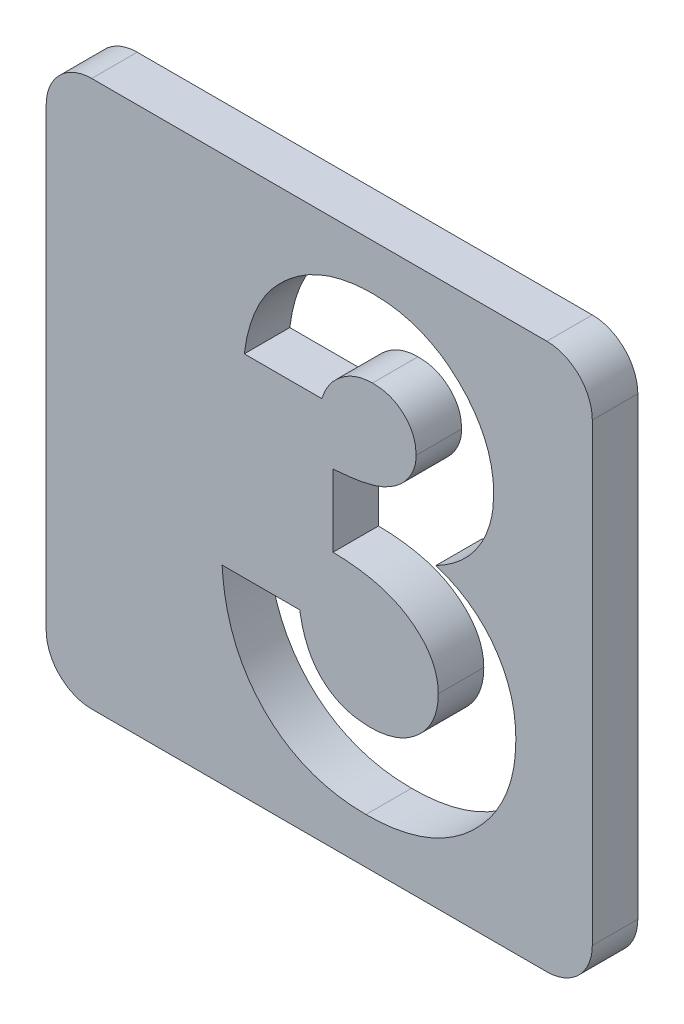
from build123d import *

# Parameters (mm, degrees)
BOSS_EXTRUDE1_DEPTH = 10
CUT_EXTRUDE1_DEPTH  = 10


with BuildPart() as part:
    # Sketch1 → Boss-Extrude1 (new body)
    with BuildSketch(Plane.XY):
        with BuildLine():
            Line((-50, 60), (50, 60))
            ThreePointArc((50, 60), (57.071067812, 57.071067812), (60, 50))
            Line((60, 50), (60, -50))
            ThreePointArc((60, -50), (57.071067812, -57.071067812), (50, -60))
            Line((50, -60), (-50, -60))
            ThreePointArc((-50, -60), (-57.071067812, -57.071067812), (-60, -50))
            Line((-60, -50), (-60, 50))
            ThreePointArc((-60, 50), (-57.071067812, 57.071067812), (-50, 60))
        make_face()
    extrude(amount=BOSS_EXTRUDE1_DEPTH)

    # Sketch2 → Cut-Extrude1 (cut)
    with BuildSketch(Plane.XY.offset(10)):
        with BuildLine():
            Line((0.576923077, 24.358974359), (-16.474358974, 24.358974359))
            add(Edge.make_bspline(
                [(-16.474358974, 24.358974359), (-16.353970438, 25.211307119), (-16.117956688, 26.882249036), (-15.553207348, 29.301356677), (-14.877706194, 31.596045832), (-14.034377515, 33.75904969), (-13.045290174, 35.794221276), (-11.920502083, 37.708544306), (-10.647853859, 39.493802146), (-9.672355516, 40.569248555), (-9.185697115, 41.105769231)],
                knots=[0, 0, 0, 0, 1.111473889, 2.178970933, 3.205615836, 4.199322666, 5.174200091, 6.12565194, 7.064921805, 8, 8, 8, 8], degree=3))
            add(Edge.make_bspline(
                [(-9.185697115, 41.105769231), (-8.483756858, 41.813669386), (-7.10030638, 43.208866194), (-4.788398372, 44.995959193), (-2.365091827, 46.542566651), (0.218213736, 47.768728226), (2.92132013, 48.761163974), (5.765723399, 49.427785309), (8.739800279, 49.87009445), (10.769233604, 49.913663441), (11.804887821, 49.935897436)],
                knots=[0, 0, 0, 0, 1.01925491, 2.00884431, 2.983262333, 3.955970413, 4.92937149, 5.924503185, 6.940838805, 8, 8, 8, 8], degree=3))
            add(Edge.make_bspline(
                [(11.804887821, 49.935897436), (12.725637707, 49.914160335), (14.535646445, 49.871429576), (17.19590386, 49.528410226), (19.732236676, 48.926792485), (22.171454673, 48.140190789), (24.477684901, 47.069887718), (26.701828098, 45.82749366), (28.781741625, 44.303645718), (30.722292085, 42.581850898), (32.505057791, 40.719561249), (34.048940704, 38.728926766), (35.376244548, 36.663121884), (36.469767354, 34.504983674), (37.31053779, 32.250860305), (37.894057408, 29.913773543), (38.275985165, 27.498880346), (38.31403515, 25.857509967), (38.333333333, 25.025040064)],
                knots=[0, 0, 0, 0, 1.091422571, 2.145516843, 3.172569842, 4.178562979, 5.178154469, 6.181868002, 7.194278174, 8.227918432, 9.254613415, 10.245994977, 11.209837596, 12.161663635, 13.10878368, 14.055455738, 15.013766427, 16, 16, 16, 16], degree=3))
            add(Edge.make_bspline(
                [(38.333333333, 25.025040064), (38.293732308, 23.994095409), (38.215770063, 21.964482346), (37.576033403, 18.993992832), (36.574671568, 16.153674752), (35.128107, 13.483268429), (33.319532856, 10.990041205), (31.100472953, 8.757349154), (28.534131878, 6.750186691), (26.607545449, 5.671537337), (25.62099359, 5.119190705)],
                knots=[0, 0, 0, 0, 0.992805628, 1.954529043, 2.915727527, 3.886831945, 4.871318353, 5.87440735, 6.911542536, 8, 8, 8, 8], degree=3))
            add(Edge.make_bspline(
                [(25.62099359, 5.119190705), (26.298147652, 4.896866769), (27.628725011, 4.460010206), (29.51998074, 3.599626149), (31.31834883, 2.659368988), (32.99286203, 1.567038026), (34.560175394, 0.366802286), (36.010734394, -0.951598279), (37.353205786, -2.385288944), (38.565674269, -3.942154462), (39.641787421, -5.5972958), (40.607326451, -7.312480175), (41.402018895, -9.113718663), (42.07522233, -10.980439908), (42.587761098, -12.929421022), (42.94863419, -14.953109858), (43.157227694, -17.046890251), (43.189041761, -18.465425199), (43.205128205, -19.182692308)],
                knots=[0, 0, 0, 0, 1.059543567, 2.081955587, 3.086750234, 4.076226789, 5.052108497, 6.020845489, 6.989030705, 7.970690546, 8.952259656, 9.923888338, 10.895517021, 11.877585046, 12.873342345, 13.889638361, 14.932918083, 16, 16, 16, 16], degree=3))
            add(Edge.make_bspline(
                [(43.205128205, -19.182692308), (43.17251882, -20.236783738), (43.108219755, -22.315237362), (42.699436391, -25.376586846), (41.938355422, -28.295311592), (40.937111249, -31.104995931), (39.601560188, -33.769367864), (38.029841121, -36.34957109), (36.097882591, -38.756124872), (33.950842418, -41.052652256), (31.566429135, -43.140552122), (28.981337229, -44.950667352), (26.252410658, -46.504068279), (23.362384275, -47.765163409), (20.312262141, -48.736350893), (17.108842711, -49.438369972), (13.738666093, -49.86787686), (11.438256871, -49.912902514), (10.263421474, -49.935897436)],
                knots=[0, 0, 0, 0, 1.005138573, 1.981928558, 2.936866704, 3.876260664, 4.820238198, 5.773547, 6.751179199, 7.756627054, 8.768222608, 9.766606018, 10.760583154, 11.757261445, 12.767156078, 13.807575856, 14.880313354, 16, 16, 16, 16], degree=3))
            add(Edge.make_bspline(
                [(10.263421474, -49.935897436), (9.152046138, -49.911653178), (6.978898733, -49.86424674), (3.800215835, -49.453919993), (0.779178625, -48.792029652), (-2.09192263, -47.859040331), (-4.801979884, -46.649112625), (-7.375568975, -45.208360206), (-9.761334505, -43.453683826), (-11.985858603, -41.464292892), (-13.999794607, -39.232309222), (-15.799779124, -36.809435607), (-17.34612218, -34.186458852), (-18.645165347, -31.374585409), (-19.686753045, -28.368882405), (-20.508354364, -25.175462089), (-21.082256332, -21.788085508), (-21.25703938, -19.457498358), (-21.346153846, -18.269230769)],
                knots=[0, 0, 0, 0, 1.066544725, 2.085487077, 3.070979577, 4.031932826, 4.977951092, 5.916076795, 6.857635327, 7.814973522, 8.776389752, 9.738577119, 10.707772778, 11.69409279, 12.707140348, 13.757286496, 14.856535458, 16, 16, 16, 16], degree=3))
            Line((-21.346153846, -18.269230769), (-4.294871795, -18.269230769))
            add(Edge.make_bspline(
                [(-4.294871795, -18.269230769), (-4.186819599, -18.866707312), (-3.97635961, -20.030449564), (-3.56587031, -21.715289641), (-3.030945483, -23.270501097), (-2.412439293, -24.709906604), (-1.744359491, -26.052405056), (-0.937159331, -27.248414671), (-0.049986198, -28.330412012), (1.2302111, -29.616702375), (3.060341313, -30.938312023), (5.531623414, -32.086853681), (8.280690724, -32.7600402), (10.202562942, -32.842166887), (11.195913462, -32.884615385)],
                knots=[0, 0, 0, 0, 0.928156231, 1.807827665, 2.648129825, 3.438902246, 4.202261636, 4.936546065, 5.639352463, 6.338805438, 7.70633318, 9.064371875, 10.482673459, 12, 12, 12, 12], degree=3))
            add(Edge.make_bspline(
                [(11.195913462, -32.884615385), (11.723020359, -32.875576377), (12.755504848, -32.857870983), (14.272070822, -32.661630398), (15.716813447, -32.338422007), (17.092423634, -31.899193782), (18.407658596, -31.34859374), (19.637389454, -30.638627935), (20.8066812, -29.813191335), (21.902822566, -28.885181468), (22.915679777, -27.873982913), (23.758436542, -26.754252311), (24.528655243, -25.616405886), (25.098314545, -24.386001717), (25.597458818, -23.129248692), (25.902960612, -21.800530617), (26.133636405, -20.427720421), (26.147042356, -19.488229388), (26.153846154, -19.011418269)],
                knots=[0, 0, 0, 0, 1.110435564, 2.175094844, 3.216326037, 4.226890168, 5.215276772, 6.21526065, 7.213097102, 8.228249917, 9.239874822, 10.221364777, 11.178138315, 12.128914389, 13.072518965, 14.022636769, 14.996447288, 16, 16, 16, 16], degree=3))
            add(Edge.make_bspline(
                [(26.153846154, -19.011418269), (26.135783345, -18.489944075), (26.099824432, -17.451808443), (25.806036347, -15.936867778), (25.342082867, -14.479616956), (24.697594812, -13.086509368), (23.836952841, -11.762679732), (22.821404918, -10.481568019), (21.570942657, -9.309853806), (20.199018093, -8.151649816), (18.608124558, -7.142045251), (16.8757408, -6.210328579), (14.956337088, -5.468969755), (12.896767777, -4.806799007), (10.658074191, -4.323159778), (8.254157787, -3.971990559), (5.688896433, -3.710599501), (3.920628445, -3.673098649), (3.012820513, -3.653846154)],
                knots=[0, 0, 0, 0, 0.809814727, 1.612155564, 2.388397, 3.182215007, 3.988903953, 4.837162975, 5.715530372, 6.646997145, 7.623086902, 8.637258368, 9.698941581, 10.815059213, 11.996518529, 13.252603015, 14.589518788, 16, 16, 16, 16], degree=3))
            Line((3.012820513, -3.653846154), (3.012820513, 12.179487179))
            add(Edge.make_bspline(
                [(3.012820513, 12.179487179), (4.143095378, 12.275745003), (6.257615816, 12.455824329), (9.192683563, 12.876946094), (11.663632261, 13.439844668), (13.729851196, 14.118951328), (15.445507012, 14.991101207), (16.944294459, 15.953916158), (18.235121106, 17.072085016), (19.326042778, 18.312264133), (20.198746175, 19.644100211), (20.816394798, 21.04689257), (21.22425768, 22.477237082), (21.262902657, 23.455549618), (21.282051282, 23.940304487)],
                knots=[0, 0, 0, 0, 1.70044513, 3.18119609, 4.440695891, 5.496282586, 6.431922213, 7.318171381, 8.16090191, 8.983045123, 9.787564368, 10.536848927, 11.275007137, 12, 12, 12, 12], degree=3))
            add(Edge.make_bspline(
                [(21.282051282, 23.940304487), (21.249014421, 24.558799065), (21.184533463, 25.76596954), (20.683739411, 27.493684792), (19.814417678, 29.033799739), (18.648809879, 30.383073548), (17.228476249, 31.510088157), (15.563596248, 32.328281547), (13.690297868, 32.809006698), (12.37233152, 32.858841698), (11.690705128, 32.884615385)],
                knots=[0, 0, 0, 0, 1.009664648, 1.970651636, 2.907870547, 3.878035693, 4.867062054, 5.849714035, 6.887914197, 8, 8, 8, 8], degree=3))
            add(Edge.make_bspline(
                [(11.690705128, 32.884615385), (11.072887442, 32.854205145), (9.846947924, 32.793861915), (8.05425741, 32.343476035), (6.351798685, 31.585307457), (4.774824861, 30.539837669), (3.346099876, 29.284272772), (2.173528872, 27.797316766), (1.198239906, 26.168055763), (0.784840597, 24.964365524), (0.576923077, 24.358974359)],
                knots=[0, 0, 0, 0, 0.98818071, 1.960853194, 2.938124878, 3.957524365, 4.978590984, 5.968022688, 6.978025184, 8, 8, 8, 8], degree=3))
        make_face()
    extrude(amount=-CUT_EXTRUDE1_DEPTH, mode=Mode.SUBTRACT)


solid = part.part
